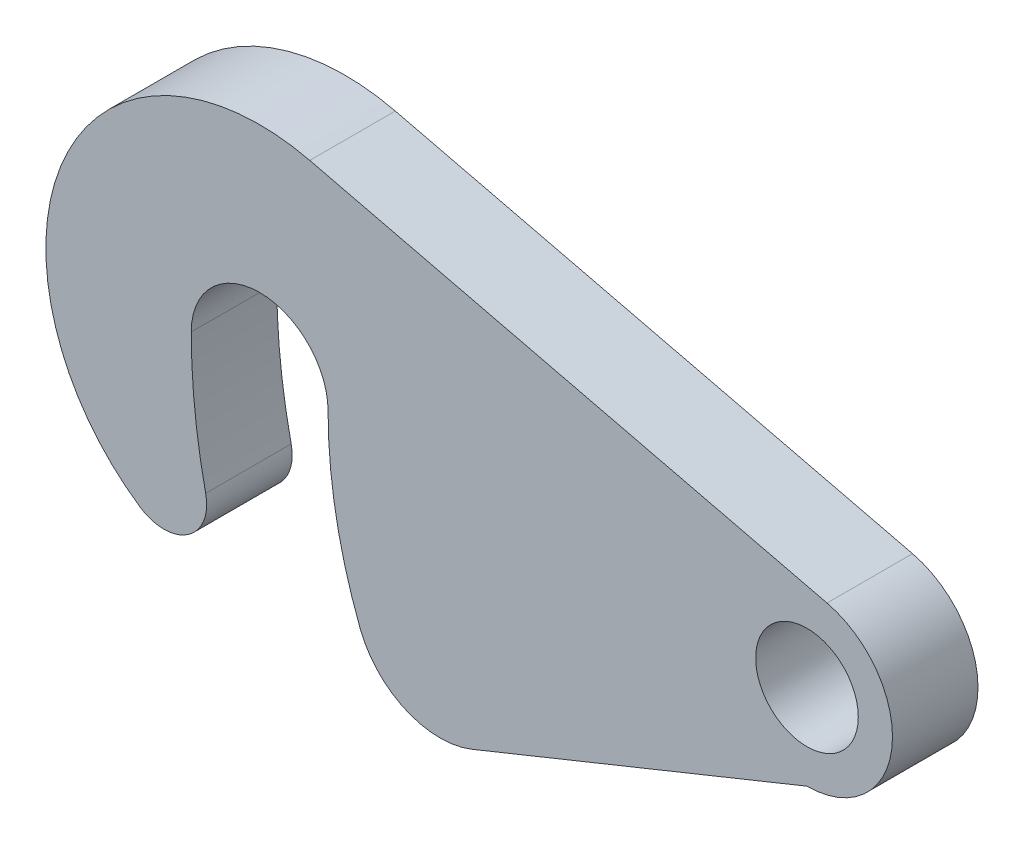
from build123d import *

# Parameters (mm, degrees)
SKETCH1_R           = 6
BOSS_EXTRUDE1_DEPTH = 5


with BuildPart() as part:
    # Sketch1 → Boss-Extrude1 (new, symmetric)
    with BuildSketch(Plane.XY):
        with BuildLine():
            ThreePointArc((0, -10), (9.930121511, -1.180121511), (2.34375, 9.721462644))
            Line((2.34375, 9.721462644), (-58.140625, 24.30365661))
            ThreePointArc((-58.140625, 24.30365661), (-86.874486916, 10.08750952), (-77.994140625, -20.716274476))
            ThreePointArc((-77.994140625, -20.716274476), (-72.385268542, -20.708675871), (-70.3125, -15.496849478))
            ThreePointArc((-70.3125, -15.496849478), (-71.576881743, -7.794228634), (-72, 0))
            ThreePointArc((-72, 0), (-64, 8), (-56, 0))
            ThreePointArc((-56, 0), (-55.051774585, -10.261681883), (-52.239210176, -20.175849925))
            ThreePointArc((-52.239210176, -20.175849925), (-46.886715458, -25.748635939), (-39.160382636, -25.843107024))
            Line((-39.160382636, -25.843107024), (0, -10))
        make_face()
        Circle(SKETCH1_R, mode=Mode.SUBTRACT)
    extrude(amount=BOSS_EXTRUDE1_DEPTH, both=True)


solid = part.part
